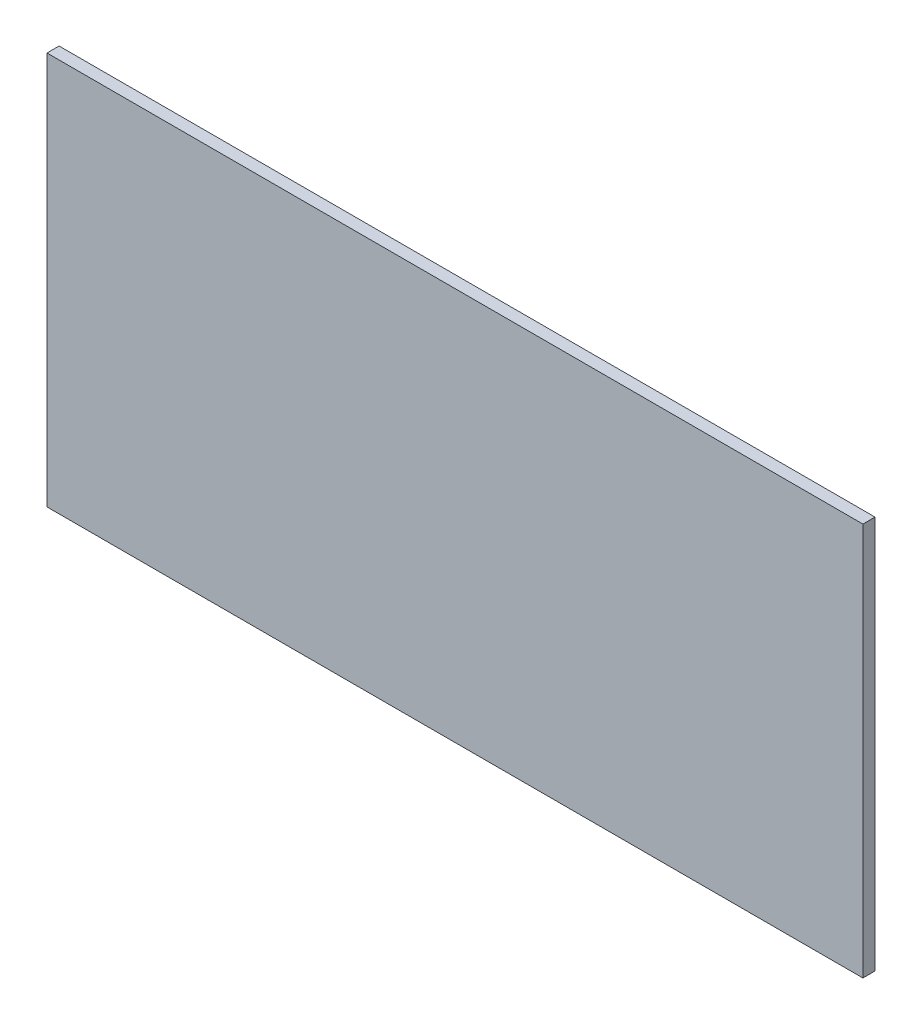
from build123d import *

# Parameters (mm, degrees)
SKETCH1_W           = 202
SKETCH1_H           = 97.33
BOSS_EXTRUDE1_DEPTH = 3


with BuildPart() as part:
    # Sketch1 → Boss-Extrude1 (new body)
    with BuildSketch(Plane.XY):
        Rectangle(SKETCH1_W, SKETCH1_H)
    extrude(amount=BOSS_EXTRUDE1_DEPTH)


solid = part.part
